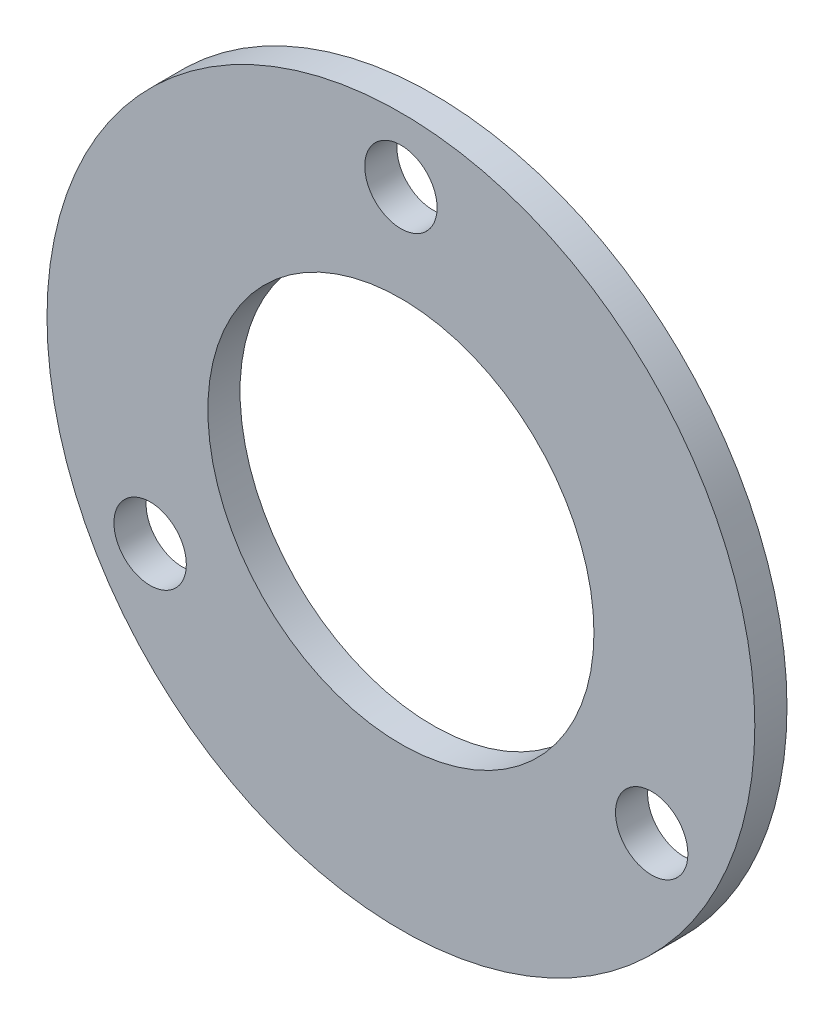
from build123d import *

# Parameters (mm, degrees)
SKETCH1_R               = 22
SKETCH1_R_2             = 12
BOSS_EXTRUDE1_DEPTH     = 1
CUT_EXTRUDE1_DEPTH      = 32.176914536
CUT_EXTRUDE1_DEPTH_BACK = 32.176914536
SKETCH2_R               = 2.25


with BuildPart() as part:
    # Sketch1 → Boss-Extrude1 (new, symmetric)
    with BuildSketch(Plane.XY):
        Circle(SKETCH1_R)
        Circle(SKETCH1_R_2, mode=Mode.SUBTRACT)
    extrude(amount=BOSS_EXTRUDE1_DEPTH, both=True)

    # Sketch2 → Cut-Extrude1 (cut, two sides: drawn at the far end of the back side and taken through both)
    with BuildSketch(Plane.XY.offset(1).offset(-CUT_EXTRUDE1_DEPTH_BACK)):
        with Locations((0, 18)):
            Circle(SKETCH2_R)
        with Locations((15.588457268, -9)):
            Circle(SKETCH2_R)
        with Locations((-15.588457268, -9)):
            Circle(SKETCH2_R)
    extrude(amount=CUT_EXTRUDE1_DEPTH + CUT_EXTRUDE1_DEPTH_BACK, mode=Mode.SUBTRACT)


solid = part.part
